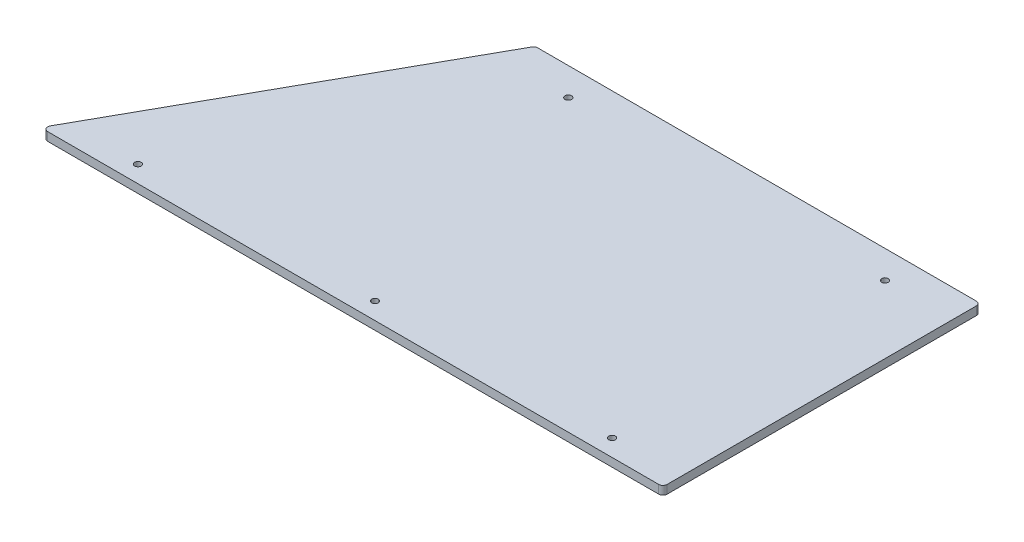
from build123d import *

# Parameters (mm, degrees)
SKETCH1_R           = 2.45745
BOSS_EXTRUDE1_DEPTH = 6.35
FILLET1_R           = 3.175


with BuildPart() as part:
    # Sketch1 → Boss-Extrude1 (new body)
    with BuildSketch(Plane(origin=(0, 0, 0), x_dir=(1, 0, 0), z_dir=(0, 1, 0))):
        Polygon((0, 0), (132.810986877, 238.125), (466.725, 238.125), (466.725, 0), align=None)
        with Locations(Location((415.925, 217.297, 0), (0, 0, 270))):
            Circle(SKETCH1_R, mode=Mode.SUBTRACT)
        with Locations(Location((415.925, 12.7, 0), (0, 0, 270))):
            Circle(SKETCH1_R, mode=Mode.SUBTRACT)
        with Locations(Location((238.125, 12.7, 0), (0, 0, 270))):
            Circle(SKETCH1_R, mode=Mode.SUBTRACT)
        with Locations(Location((60.325, 12.7, 0), (0, 0, 270))):
            Circle(SKETCH1_R, mode=Mode.SUBTRACT)
        with Locations(Location((178.449400022, 217.297, 0), (0, 0, 270))):
            Circle(SKETCH1_R, mode=Mode.SUBTRACT)
    extrude(amount=BOSS_EXTRUDE1_DEPTH)

    # Fillet1
    fillet1_edges = [part.edges().sort_by_distance(p)[0] for p in [
        (0, 3.175, 0),
        (132.810986877, 3.175, -238.125),
        (466.725, 3.175, -238.125),
        (466.725, 3.175, 0),
    ]]
    fillet(fillet1_edges, radius=FILLET1_R)


solid = part.part
